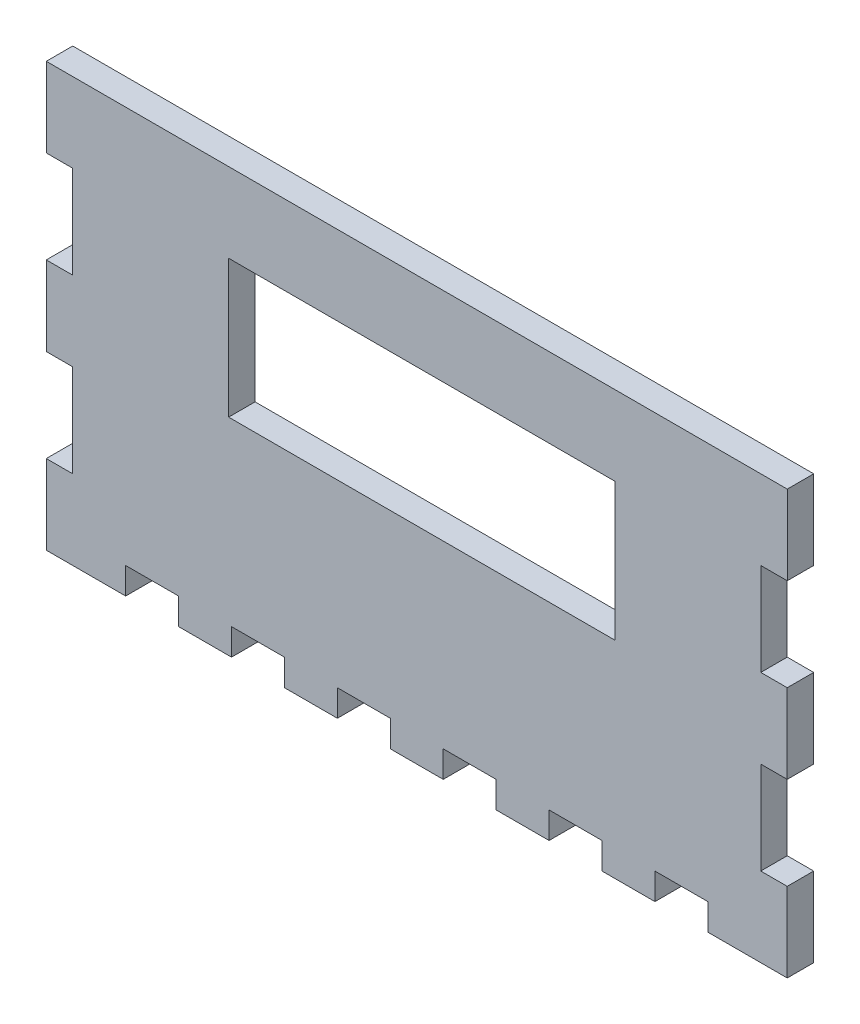
from build123d import *

# Parameters (mm, degrees)
BOSS_EXTRUDE1_DEPTH = 5
SKETCH3_W           = 73
SKETCH3_H           = 26
CUT_EXTRUDE1_DEPTH  = 84.023651357


with BuildPart() as part:
    # Sketch1 → Boss-Extrude1 (new body)
    with BuildSketch(Plane.XY):
        Polygon((69.038630962, -4.683293815), (64.038630962, -4.683293815), (64.038630962, -22.183293815), (69.038630962, -22.183293815), (69.038630962, -37.183293815), (54.044687612, -37.183293815), (54.044687612, -32.183293815), (44.044687612, -32.183293815), (44.044687612, -37.183293815), (34.044687612, -37.183293815), (34.044687612, -32.183293815), (24.044687612, -32.183293815), (24.044687612, -37.183293815), (14.044687612, -37.183293815), (14.044687612, -32.183293815), (4.044687612, -32.183293815), (4.044687612, -37.183293815), (-5.955312388, -37.183293815), (-5.955312388, -32.183293815), (-15.955312388, -32.183293815), (-15.955312388, -37.183293815), (-25.955312388, -37.183293815), (-25.955312388, -32.183293815), (-35.955312388, -32.183293815), (-35.955312388, -37.183293815), (-45.955312388, -37.183293815), (-45.955312388, -32.183293815), (-55.955312388, -32.183293815), (-55.955312388, -37.183293815), (-70.955312388, -37.183293815), (-70.955312388, -22.183293815), (-65.955312388, -22.183293815), (-65.955312388, -4.683293815), (-70.955312388, -4.683293815), (-70.955312388, 10.316706185), (-65.955312388, 10.316706185), (-65.955312388, 27.816706185), (-70.955312388, 27.816706185), (-70.955312388, 42.816706185), (69.044687612, 42.816706185), (69.044687612, 27.816706185), (64.038630962, 27.816706185), (64.038630962, 10.316706185), (69.038630962, 10.316706185), align=None)
    extrude(amount=BOSS_EXTRUDE1_DEPTH)

    # Sketch3 → Cut-Extrude1 (cut, through all)
    with BuildSketch(Plane.XY.offset(5)):
        with Locations((0, 14.816706185)):
            Rectangle(SKETCH3_W, SKETCH3_H)
    extrude(amount=-CUT_EXTRUDE1_DEPTH, mode=Mode.SUBTRACT)


solid = part.part
